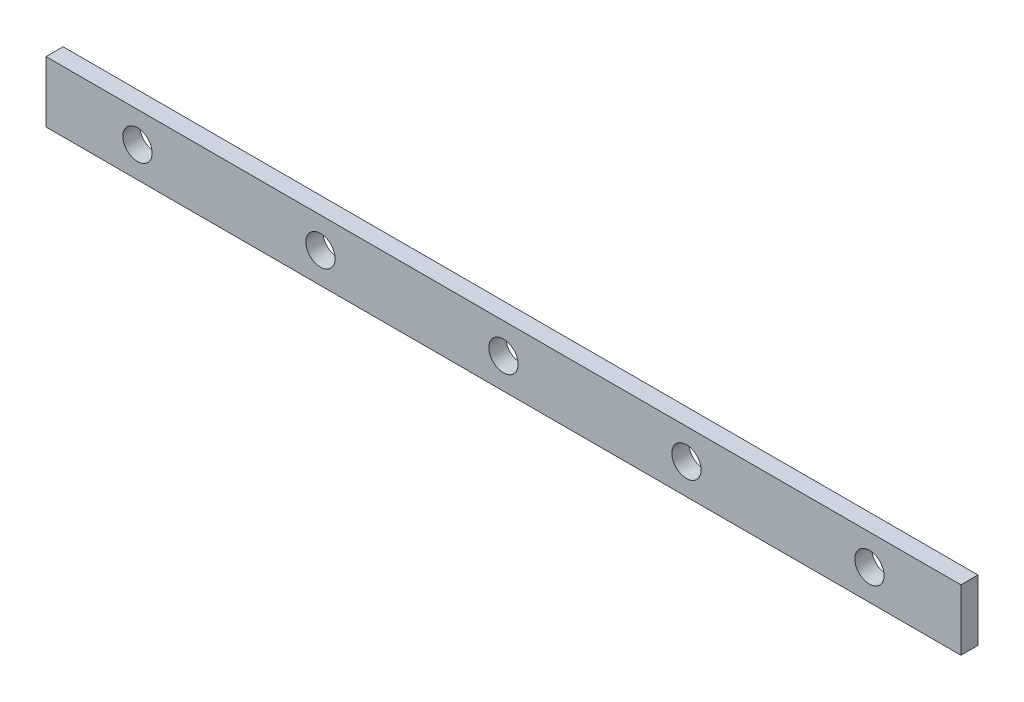
from build123d import *

# Parameters (mm, degrees)
SKETCH_1_W          = 75
SKETCH_1_H          = 5
EXTRUDE_1_DEPTH     = 1.4
SKETCH_2_R          = 1.2
CUT_EXTRUDE_1_DEPTH = 51.4


with BuildPart() as part:
    # 草图1 → 凸台-拉伸1 (new body)
    with BuildSketch(Plane.XY):
        Rectangle(SKETCH_1_W, SKETCH_1_H)
    extrude(amount=EXTRUDE_1_DEPTH)

    # 草图2 → 切除-拉伸1 (cut)
    with BuildSketch(Plane.XY.offset(1.4)):
        with Locations((-30, 0)):
            Circle(SKETCH_2_R)
        with Locations((-15, 0)):
            Circle(SKETCH_2_R)
        Circle(SKETCH_2_R)
        with Locations((15, 0)):
            Circle(SKETCH_2_R)
        with Locations((30, 0)):
            Circle(SKETCH_2_R)
    extrude(amount=-CUT_EXTRUDE_1_DEPTH, mode=Mode.SUBTRACT)


solid = part.part
